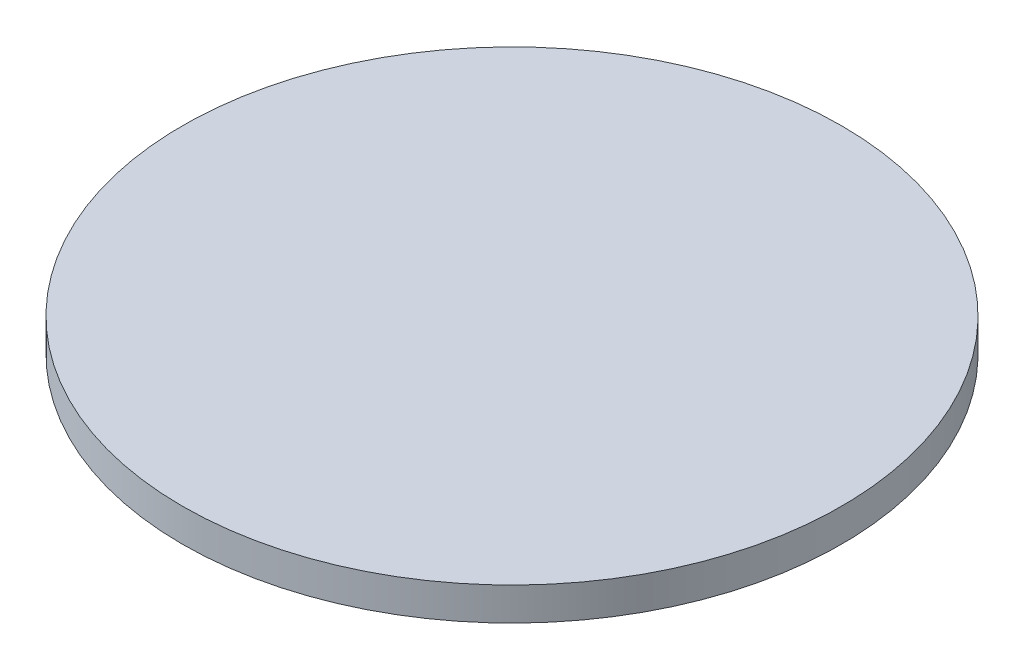
from build123d import *

# Parameters (mm, degrees)
KOLA330_KAPAK_D60_START = 112
SKETCH1_R               = 30
KOLA330_KAPAK_D60_DEPTH = 3


with BuildPart() as part:
    # Sketch1 → KOLA330_kapak_D60 (new body)
    with BuildSketch(Plane(origin=(0, 0, 0), x_dir=(1, 0, 0), z_dir=(0, 1, 0)).offset(KOLA330_KAPAK_D60_START)):
        with Locations(Location((0, 0, 0), (0, 0, 270))):
            Circle(SKETCH1_R)
    extrude(amount=KOLA330_KAPAK_D60_DEPTH)


solid = part.part
